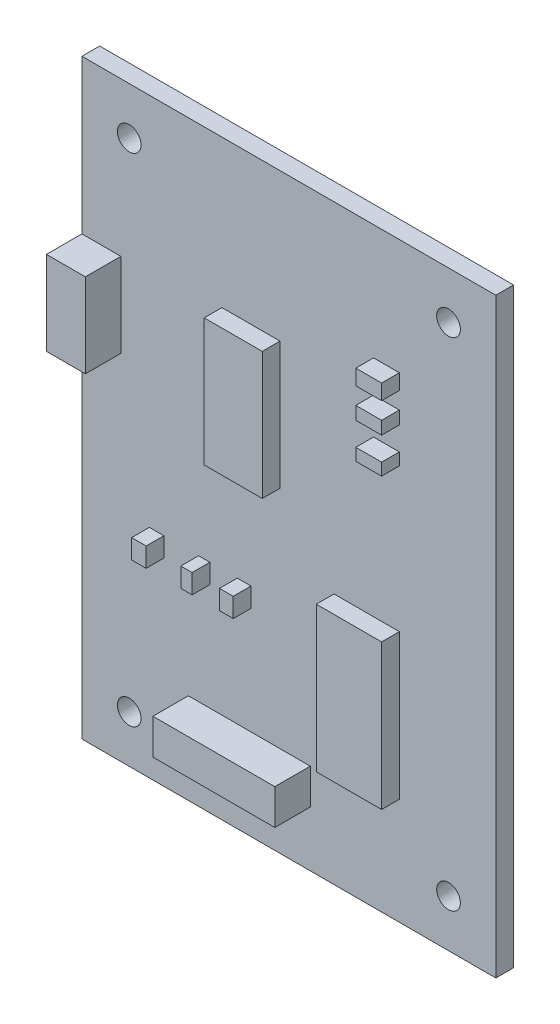
from build123d import *

# Parameters (mm, degrees)
SKETCH_1_W          = 70
SKETCH_1_H          = 100
EXTRUDE_1_DEPTH     = 3
SKETCH_2_R          = 2
CUT_EXTRUDE_1_DEPTH = 123.102416029
SKETCH_3_W          = 9.819716148
SKETCH_3_H          = 21.548821549
SKETCH_3_W_2        = 11.047180667
SKETCH_3_H_2        = 24.549290372
SKETCH_3_W_3        = 2.454929037
SKETCH_3_H_3        = 3.273238716
SKETCH_3_W_4        = 1.909389251
SKETCH_3_W_5        = 2.318544091
SKETCH_3_W_6        = 4.364318288
SKETCH_3_H_4        = 2.045774198
SKETCH_3_H_5        = 2.182159144
SKETCH_3_H_6        = 2.591313983
EXTRUDE_2_DEPTH     = 3
SKETCH_4_W          = 6.582292946
SKETCH_4_H          = 14.208853527
SKETCH_4_W_2        = 20.616767863
SKETCH_4_H_2        = 5.990006879
EXTRUDE_3_DEPTH     = 6


with BuildPart() as part:
    # Эскиз1 → Бобышка-Вытянуть1 (new body)
    with BuildSketch(Plane.XY):
        with Locations((35, 50)):
            Rectangle(SKETCH_1_W, SKETCH_1_H)
    extrude(amount=EXTRUDE_1_DEPTH)

    # Эскиз2 → Вырез-Вытянуть1 (cut, through all)
    with BuildSketch(Plane.XY.offset(3)):
        with Locations((8, 92)):
            Circle(SKETCH_2_R)
        with Locations((62, 92)):
            Circle(SKETCH_2_R)
        with Locations(Location((62, 8, 0), (0, 0, 180))):
            Circle(SKETCH_2_R)
        with Locations(Location((8, 8, 0), (0, 0, 180))):
            Circle(SKETCH_2_R)
    extrude(amount=-CUT_EXTRUDE_1_DEPTH, mode=Mode.SUBTRACT)

    # Эскиз3 → Бобышка-Вытянуть2 (add)
    with BuildSketch(Plane.XY.offset(3)):
        with Locations((28.589907514, 64.252226911)):
            Rectangle(SKETCH_3_W, SKETCH_3_H)
        with Locations((48.161147339, 30.292375229)):
            Rectangle(SKETCH_3_W_2, SKETCH_3_H_2)
        with Locations((12.632868773, 35.065848357)):
            Rectangle(SKETCH_3_W_3, SKETCH_3_H_3)
        with Locations((20.679580617, 35.065848357)):
            Rectangle(SKETCH_3_W_4, SKETCH_3_H_3)
        with Locations((27.430635469, 35.065848357)):
            Rectangle(SKETCH_3_W_5, SKETCH_3_H_3)
        with Locations((51.502578528, 67.866427993)):
            Rectangle(SKETCH_3_W_6, SKETCH_3_H_4)
        with Locations((51.502578528, 73.935558113)):
            Rectangle(SKETCH_3_W_6, SKETCH_3_H_5)
        with Locations((51.502578528, 79.186378554)):
            Rectangle(SKETCH_3_W_6, SKETCH_3_H_6)
    extrude(amount=EXTRUDE_2_DEPTH)

    # Эскиз4 → Бобышка-Вытянуть3 (add)
    with BuildSketch(Plane.XY.offset(3)):
        with Locations((3.291146473, 66.880429277)):
            Rectangle(SKETCH_4_W, SKETCH_4_H)
        with Locations((28.313480694, 12.343506182)):
            Rectangle(SKETCH_4_W_2, SKETCH_4_H_2)
    extrude(amount=EXTRUDE_3_DEPTH)


solid = part.part
